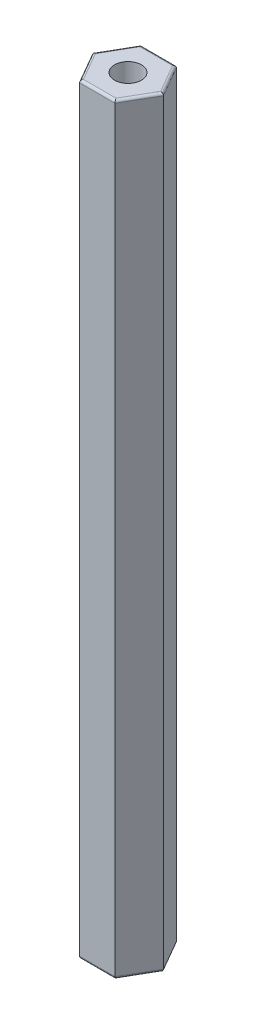
from build123d import *

# Parameters (mm, degrees)
RESSALTO_EXTRUS_O1_DEPTH = 62
FILETE1_R                = 0.2
ESBO_O3_R                = 1.0922
CORTE_EXTRUS_O1_DEPTH    = 5
CORTE_EXTRUS_O2_START    = -5
ESBO_O2_R                = 1.0922
CORTE_EXTRUS_O2_DEPTH    = 5


with BuildPart() as part:
    # Esboço1 → Ressalto-extrusão1 (new body)
    with BuildSketch(Plane(origin=(0, 0, 0), x_dir=(1, 0, 0), z_dir=(0, 1, 0))):
        Polygon((2.886751346, 0), (1.443375673, 2.5), (-1.443375673, 2.5), (-2.886751346, 0), (-1.443375673, -2.5), (1.443375673, -2.5), align=None)
    extrude(amount=RESSALTO_EXTRUS_O1_DEPTH)

    # Filete1
    filete1_edges = [part.edges().sort_by_distance(p)[0] for p in [
        (0, 62, -2.5),
        (-2.165063509, 62, -1.25),
        (-2.165063509, 62, 1.25),
        (0, 62, 2.5),
        (2.165063509, 62, 1.25),
        (0, 0, 2.5),
        (-2.165063509, 0, 1.25),
        (-2.165063509, 0, -1.25),
        (2.165063509, 62, -1.25),
        (0, 0, -2.5),
        (2.165063509, 0, -1.25),
        (2.165063509, 0, 1.25),
    ]]
    fillet(filete1_edges, radius=FILETE1_R)

    # Esboço3 → Corte-extrusão1 (cut)
    with BuildSketch(Plane(origin=(0, 62, 0), x_dir=(1, 0, 0), z_dir=(0, 1, 0))):
        with Locations(Location((0, 0, 0), (0, 0, 270))):
            Circle(ESBO_O3_R)
    extrude(amount=-CORTE_EXTRUS_O1_DEPTH, mode=Mode.SUBTRACT)

    # Esboço2 → Corte-extrusão2 (cut)
    with BuildSketch(Plane.XZ.offset(CORTE_EXTRUS_O2_START)):
        with Locations(Location((0, 0, 0), (0, 0, 90))):
            Circle(ESBO_O2_R)
    extrude(amount=CORTE_EXTRUS_O2_DEPTH, mode=Mode.SUBTRACT)


solid = part.part
